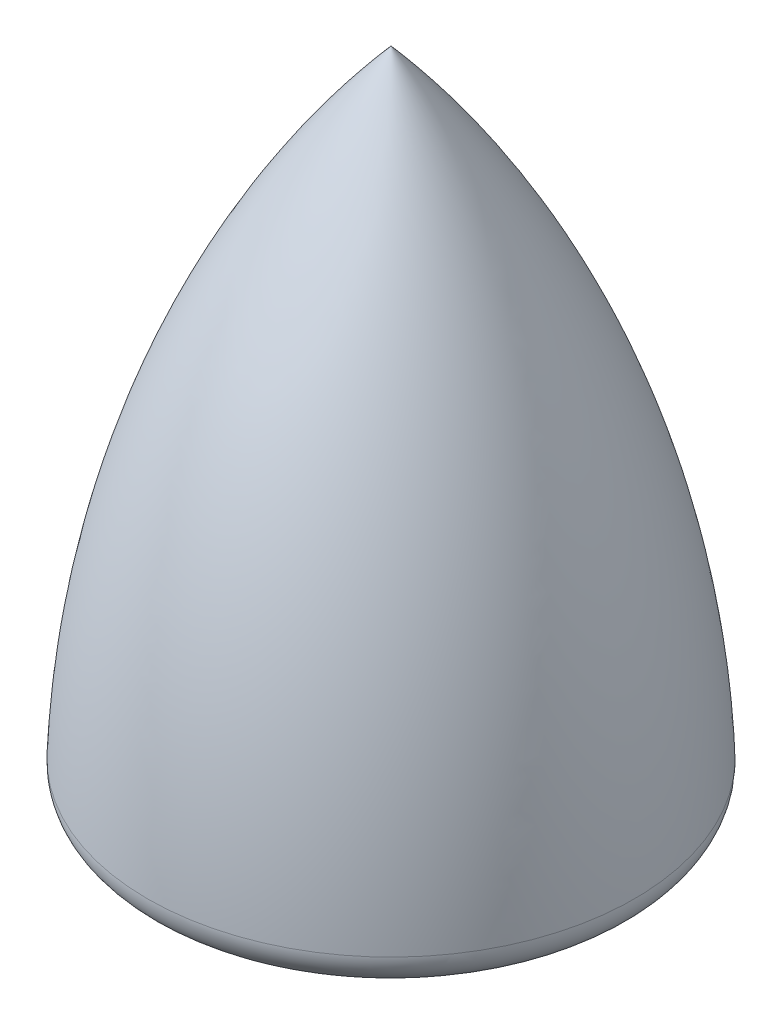
from build123d import *

# Parameters (mm, degrees)
FILLET5_R          = 1
SKETCH4_R          = 2.5
CUT_EXTRUDE1_DEPTH = 12


with BuildPart() as part:
    # Sketch2 → Revolve1 (revolve)
    with BuildSketch(Plane(origin=(0, 0, 0), x_dir=(0, 0, -1), z_dir=(1, 0, 0))):
        with BuildLine():
            Line((0, -10.428499504), (7.5, -10.428499504))
            ThreePointArc((7.5, -10.428499504), (5.539425838, 0.242535185), (0, 9.571500496))
            Line((0, 9.571500496), (0, -10.428499504))
        make_face()
    revolve(axis=Axis((0, 9.571500496, 0), (0, -1, 0)))

    # Fillet5
    fillet5_edges = [part.edges().sort_by_distance(p)[0] for p in [
        (0, -10.428499504, 7.5),
    ]]
    fillet(fillet5_edges, radius=FILLET5_R)

    # Sketch4 → Cut-Extrude1 (cut)
    with BuildSketch(Plane.XZ.offset(10.428499504)):
        with Locations(Location((0, 0, 0), (0, 0, 270))):
            Circle(SKETCH4_R)
    extrude(amount=-CUT_EXTRUDE1_DEPTH, mode=Mode.SUBTRACT)


solid = part.part
